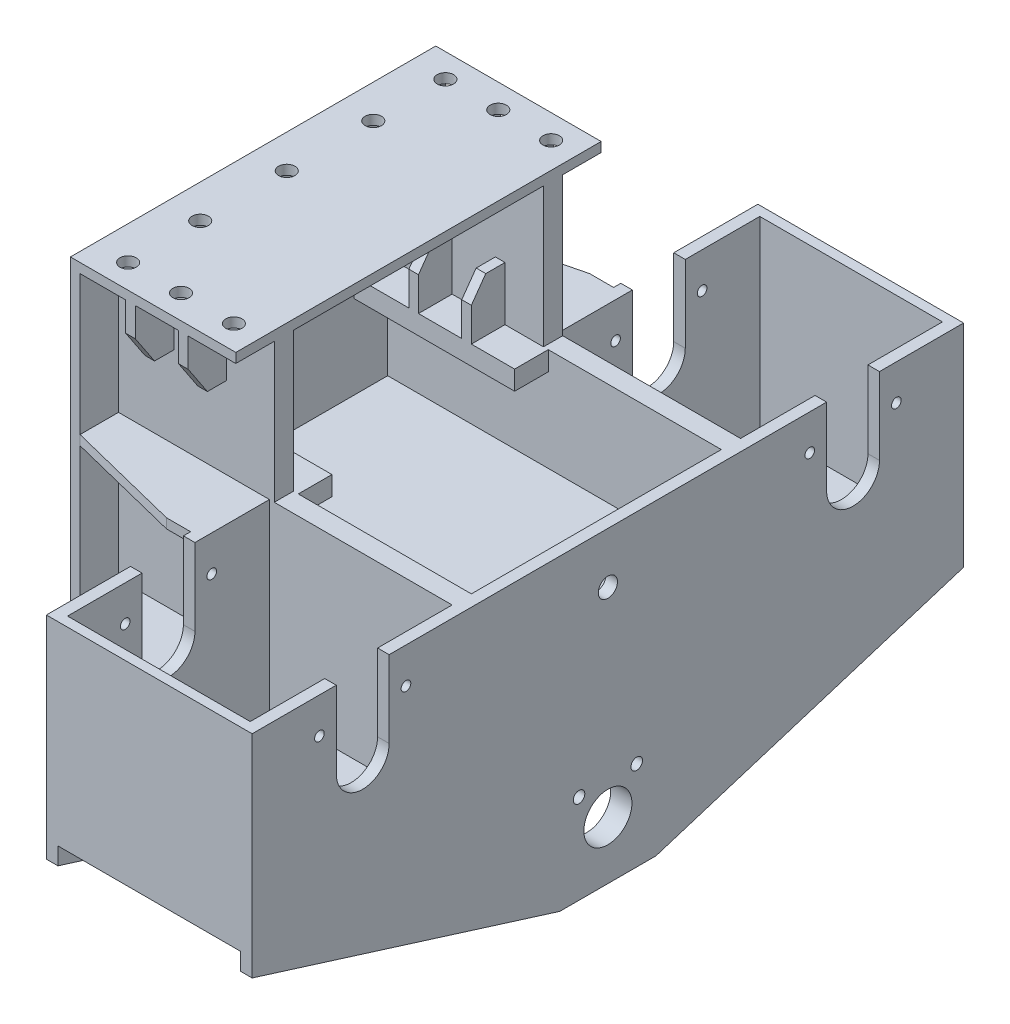
from build123d import *
from build123d.topology import SkipClean

# Parameters (mm, degrees)
SKETCH_1_W             = 172
SKETCH_1_H             = 380
EXTRUDE_1_DEPTH        = 10
SKETCH_2_R             = 8.5
CUT_EXTRUDE_1_DEPTH    = 10
SKETCH_3_W             = 10
SKETCH_3_H             = 380
EXTRUDE_2_DEPTH        = 347
SKETCH_4_R             = 7
CUT_EXTRUDE_2_DEPTH    = 10
SKETCH_5_W             = 162
SKETCH_5_H             = 20
EXTRUDE_3_DEPTH        = 347
SKETCH_6_W             = 20
SKETCH_6_H             = 285
EXTRUDE_4_DEPTH        = 185
SKETCH_9_W             = 5
SKETCH_9_H             = 20
EXTRUDE_6_DEPTH        = 83
SKETCH_7_R             = 5
SKETCH_7_R_2           = 10
SKETCH_7_R_3           = 25
SKETCH_7_R_4           = 6
EXTRUDE_5_DEPTH        = 12
PATTERN_LINEAR_1_COUNT = 2
PATTERN_LINEAR_1_PITCH = 202
CUT_EXTRUDE_3_DEPTH    = 12
EXTRUDE_7_DEPTH        = 347
SKETCH_13_W            = 260
SKETCH_13_H            = 10
EXTRUDE_10_DEPTH       = 359
SKETCH_14_W            = 190
SKETCH_14_H            = 10
EXTRUDE_11_DEPTH       = 190
SKETCH_15_W            = 190
SKETCH_15_H            = 220
EXTRUDE_12_DEPTH       = 12
SKETCH_16_W            = 145
SKETCH_16_H            = 10
EXTRUDE_13_DEPTH       = 80
CUT_EXTRUDE_4_DEPTH    = 790.167916226
SKETCH_18_W            = 70
SKETCH_18_H            = 10
EXTRUDE_14_DEPTH       = 145
CUT_EXTRUDE_5_DEPTH    = 741.935894663
SKETCH_20_W            = 35
SKETCH_20_H            = 20
EXTRUDE_15_DEPTH       = 167
SKETCH_21_W            = 10
SKETCH_21_H            = 56
EXTRUDE_16_DEPTH       = 35
SKETCH_22_W            = 10
SKETCH_22_H            = 56
EXTRUDE_17_DEPTH       = 35
CUT_EXTRUDE_6_DEPTH    = 65
SKETCH_24_W            = 50
SKETCH_24_H            = 10
EXTRUDE_18_DEPTH       = 50
CUT_EXTRUDE_7_DEPTH    = 100
SKETCH_26_W            = 10
SKETCH_26_H            = 40
EXTRUDE_19_DEPTH       = 60
CUT_EXTRUDE_8_DEPTH    = 65
EXTRUDE_START          = 10
SKETCH_28_R            = 25
SKETCH_28_R_2          = 6
EXTRUDE_20_DEPTH       = 10
PATTERN_LINEAR_2_COUNT = 2
PATTERN_LINEAR_2_PITCH = 180


with BuildPart() as part:
    # 草图1 → 凸台-拉伸1 (new body)
    with BuildSketch(Plane(origin=(0, 0, 0), x_dir=(1, 0, 0), z_dir=(0, 1, 0))):
        with Locations((86, 190)):
            Rectangle(SKETCH_1_W, SKETCH_1_H)
    extrude(amount=EXTRUDE_1_DEPTH)

    # 草图2 → 切除-拉伸1 (cut)
    with BuildSketch(Plane(origin=(0, 10, 0), x_dir=(1, 0, 0), z_dir=(0, 1, 0))):
        with Locations(Location((35, 355, 0), (0, 0, 270))):
            Circle(SKETCH_2_R)
        with Locations(Location((35, 280, 0), (0, 0, 270))):
            Circle(SKETCH_2_R)
        with Locations(Location((35, 190, 0), (0, 0, 270))):
            Circle(SKETCH_2_R)
        with Locations(Location((35, 100, 0), (0, 0, 270))):
            Circle(SKETCH_2_R)
        with Locations(Location((35, 25, 0), (0, 0, 270))):
            Circle(SKETCH_2_R)
        with Locations(Location((90, 25, 0), (0, 0, 270))):
            Circle(SKETCH_2_R)
        with Locations(Location((145, 25, 0), (0, 0, 270))):
            Circle(SKETCH_2_R)
        with Locations(Location((90, 355, 0), (0, 0, 270))):
            Circle(SKETCH_2_R)
        with Locations(Location((145, 355, 0), (0, 0, 270))):
            Circle(SKETCH_2_R)
    extrude(amount=-CUT_EXTRUDE_1_DEPTH, mode=Mode.SUBTRACT)

    # 草图3 → 凸台-拉伸2 (add)
    with BuildSketch(Plane.XZ):
        with Locations((5, -190)):
            Rectangle(SKETCH_3_W, SKETCH_3_H)
    extrude(amount=EXTRUDE_2_DEPTH)

    # 草图4 → 切除-拉伸2 (cut)
    with BuildSketch(Plane.ZY):
        with Locations((-133, -75)):
            Circle(SKETCH_4_R)
        with Locations((-247, -75)):
            Circle(SKETCH_4_R)
        with Locations((-133, -118)):
            Circle(SKETCH_4_R)
        with Locations((-247, -118)):
            Circle(SKETCH_4_R)
        Polygon((-235.5, -347), (-144.5, -347), (-190, -324.968736425), align=None)
    extrude(amount=-CUT_EXTRUDE_2_DEPTH, mode=Mode.SUBTRACT)

    # 草图5 → 凸台-拉伸3 (add)
    with BuildSketch(Plane.XZ):
        with Locations((91, -50)):
            Rectangle(SKETCH_5_W, SKETCH_5_H)
        with Locations((91, -330)):
            Rectangle(SKETCH_5_W, SKETCH_5_H)
    extrude(amount=EXTRUDE_3_DEPTH)

    # 草图6 → 凸台-拉伸4 (add)
    with BuildSketch(Plane(origin=(172, 0, 0), x_dir=(0, 0, -1), z_dir=(1, 0, 0))):
        with Locations((50, -287.5)):
            Rectangle(SKETCH_6_W, SKETCH_6_H)
        with Locations((330, -287.5)):
            Rectangle(SKETCH_6_W, SKETCH_6_H)
    extrude(amount=EXTRUDE_4_DEPTH)

    # 草图9 → 凸台-拉伸6 (add)
    with BuildSketch(Plane.XZ.offset(347)):
        with Locations((169.5, -330)):
            Rectangle(SKETCH_9_W, SKETCH_9_H)
        with Locations((169.5, -50)):
            Rectangle(SKETCH_9_W, SKETCH_9_H)
    extrude(amount=EXTRUDE_6_DEPTH)

    # 草图7 → 凸台-拉伸5 (add)
    with BuildSketch(Plane(origin=(357, 0, 0), x_dir=(0, 0, -1), z_dir=(1, 0, 0))):
        with BuildLine():
            Line((-37.5, -145), (417.5, -145))
            Line((417.5, -145), (417.5, -225))
            ThreePointArc((417.5, -225), (445, -252.5), (472.5, -225))
            Line((472.5, -225), (472.5, -145))
            Line((472.5, -145), (560, -145))
            Line((560, -145), (560, -365))
            Line((560, -365), (240, -465))
            Line((240, -465), (140, -465))
            Line((140, -465), (-180, -365))
            Line((-180, -365), (-180, -145))
            Line((-180, -145), (-92.5, -145))
            Line((-92.5, -145), (-92.5, -225))
            ThreePointArc((-92.5, -225), (-65, -252.5), (-37.5, -225))
            Line((-37.5, -225), (-37.5, -145))
        make_face()
        with Locations((490, -182)):
            Circle(SKETCH_7_R, mode=Mode.SUBTRACT)
        with Locations((400, -182)):
            Circle(SKETCH_7_R, mode=Mode.SUBTRACT)
        with Locations((-110, -182)):
            Circle(SKETCH_7_R, mode=Mode.SUBTRACT)
        with Locations((-20, -182)):
            Circle(SKETCH_7_R, mode=Mode.SUBTRACT)
        with Locations((190, -198)):
            Circle(SKETCH_7_R_2, mode=Mode.SUBTRACT)
        with Locations((190, -405)):
            Circle(SKETCH_7_R_3, mode=Mode.SUBTRACT)
        with Locations((160, -372)):
            Circle(SKETCH_7_R_4, mode=Mode.SUBTRACT)
        with Locations((220, -372)):
            Circle(SKETCH_7_R_4, mode=Mode.SUBTRACT)
    extrude_5 = extrude(amount=EXTRUDE_5_DEPTH)

    # 阵列(线性)1: 凸台-拉伸5 ×2
    with Locations(*[(-i * PATTERN_LINEAR_1_PITCH, 0, 0) for i in range(1, PATTERN_LINEAR_1_COUNT)]):
        add(extrude_5)

    # 草图8 → 切除-拉伸3 (cut)
    with BuildSketch(Plane(origin=(167, 0, 0), x_dir=(0, 0, -1), z_dir=(1, 0, 0))):
        Polygon((60, -145), (320, -145), (320, -347), (265, -347), (190, -325), (115, -347), (60, -347), align=None)
    extrude(amount=-CUT_EXTRUDE_3_DEPTH, mode=Mode.SUBTRACT)

    # 草图11 → 凸台-拉伸7 (add)
    with BuildSketch(Plane(origin=(10, 0, 0), x_dir=(0, 0, -1), z_dir=(1, 0, 0))):
        Polygon((60, -335), (115, -335), (190, -313), (265, -335), (320, -335), (320, -347), (265, -347), (190, -325), (115, -347), (60, -347), align=None)
    extrude(amount=EXTRUDE_7_DEPTH)

    # 草图13 → 凸台-拉伸10 (add)
    with BuildSketch(Plane(origin=(369, 0, 0), x_dir=(0, 0, -1), z_dir=(1, 0, 0))):
        with Locations((190, -257)):
            Rectangle(SKETCH_13_W, SKETCH_13_H)
    extrude(amount=-EXTRUDE_10_DEPTH)

    # 草图14 → 凸台-拉伸11 (add)
    with BuildSketch(Plane(origin=(0, -145, 0), x_dir=(1, 0, 0), z_dir=(0, 1, 0))):
        with Locations((262, -175)):
            Rectangle(SKETCH_14_W, SKETCH_14_H)
        with Locations((262, 555)):
            Rectangle(SKETCH_14_W, SKETCH_14_H)
    extrude(amount=-EXTRUDE_11_DEPTH)

    # 草图15 → 凸台-拉伸12 (add)
    with BuildSketch(Plane(origin=(0, -335, 0), x_dir=(-1, 0, 0), z_dir=(0, -1, 0))):
        with Locations((-262, -70)):
            Rectangle(SKETCH_15_W, SKETCH_15_H)
        with Locations((-262, 450)):
            Rectangle(SKETCH_15_W, SKETCH_15_H)
    extrude(amount=EXTRUDE_12_DEPTH)

    # 草图16 → 凸台-拉伸13 (add)
    with BuildSketch(Plane(origin=(0, -347, 0), x_dir=(-1, 0, 0), z_dir=(0, -1, 0))):
        with Locations((-82.5, 45)):
            Rectangle(SKETCH_16_W, SKETCH_16_H)
        with Locations((-82.5, 335)):
            Rectangle(SKETCH_16_W, SKETCH_16_H)
    extrude(amount=EXTRUDE_13_DEPTH)

    # 草图17 → 切除-拉伸4 (cut, through all)
    with BuildSketch(Plane.XY.offset(-40)):
        Polygon((10, -427), (10, -397), (55, -427), align=None)
    extrude(amount=-CUT_EXTRUDE_4_DEPTH, mode=Mode.SUBTRACT)

    # 草图18 → 凸台-拉伸14 (add)
    with BuildSketch(Plane.ZY.offset(-155)):
        with Locations((-5, -150)):
            Rectangle(SKETCH_18_W, SKETCH_18_H)
        with Locations((-375, -150)):
            Rectangle(SKETCH_18_W, SKETCH_18_H)
        with Locations((-375, -300)):
            Rectangle(SKETCH_18_W, SKETCH_18_H)
        with Locations((-5, -300)):
            Rectangle(SKETCH_18_W, SKETCH_18_H)
    extrude(amount=EXTRUDE_14_DEPTH)

    # 草图19 → 切除-拉伸5 (cut, through all)
    with BuildSketch(Plane(origin=(0, -305, 0), x_dir=(-1, 0, 0), z_dir=(0, -1, 0))):
        Polygon((-10, -30), (-10, 0), (-130, -30), align=None)
        Polygon((-10, 410), (-10, 380), (-130, 410), align=None)
    extrude(amount=-CUT_EXTRUDE_5_DEPTH, mode=Mode.SUBTRACT)

    # 草图20 → 凸台-拉伸15 (add)
    with BuildSketch(Plane(origin=(10, 0, 0), x_dir=(0, 0, -1), z_dir=(1, 0, 0))):
        with Locations((77.5, -155)):
            Rectangle(SKETCH_20_W, SKETCH_20_H)
        with Locations((302.5, -155)):
            Rectangle(SKETCH_20_W, SKETCH_20_H)
    extrude(amount=EXTRUDE_15_DEPTH)

    # 草图21 → 凸台-拉伸16 (add)
    with BuildSketch(Plane.XY.offset(-320)):
        with Locations((72, -117)):
            Rectangle(SKETCH_21_W, SKETCH_21_H)
        with Locations((127, -117)):
            Rectangle(SKETCH_21_W, SKETCH_21_H)
    extrude(amount=EXTRUDE_16_DEPTH)

    # 草图22 → 凸台-拉伸17 (add)
    with BuildSketch(Plane(origin=(0, 0, -60), x_dir=(-1, 0, 0), z_dir=(0, 0, -1))):
        with Locations((-127, -117)):
            Rectangle(SKETCH_22_W, SKETCH_22_H)
        with Locations((-72, -117)):
            Rectangle(SKETCH_22_W, SKETCH_22_H)
    extrude(amount=EXTRUDE_17_DEPTH)

    # 草图23 → 切除-拉伸6 (cut)
    with BuildSketch(Plane(origin=(132, 0, 0), x_dir=(0, 0, -1), z_dir=(1, 0, 0))):
        Polygon((95, -89), (80, -89), (95, -110), align=None)
        Polygon((285, -89), (300, -89), (285, -110), align=None)
    extrude(amount=-CUT_EXTRUDE_6_DEPTH, mode=Mode.SUBTRACT)

    # 草图24 → 凸台-拉伸18 (add)
    with BuildSketch(Plane.XZ):
        with Locations((35, -145)):
            Rectangle(SKETCH_24_W, SKETCH_24_H)
        with Locations((35, -235)):
            Rectangle(SKETCH_24_W, SKETCH_24_H)
    extrude(amount=EXTRUDE_18_DEPTH)

    # 草图25 → 切除-拉伸7 (cut)
    with BuildSketch(Plane(origin=(0, 0, -240), x_dir=(-1, 0, 0), z_dir=(0, 0, -1))):
        Polygon((-60, -50), (-60, -20), (-30, -50), align=None)
    extrude(amount=-CUT_EXTRUDE_7_DEPTH, mode=Mode.SUBTRACT)

    # 草图26 → 凸台-拉伸19 (add)
    with BuildSketch(Plane.XZ):
        with Locations((117.5, -360)):
            Rectangle(SKETCH_26_W, SKETCH_26_H)
        with Locations((62.5, -360)):
            Rectangle(SKETCH_26_W, SKETCH_26_H)
        with Locations((117.5, -20)):
            Rectangle(SKETCH_26_W, SKETCH_26_H)
        with Locations((62.5, -20)):
            Rectangle(SKETCH_26_W, SKETCH_26_H)
    extrude(amount=EXTRUDE_19_DEPTH)

    # 草图27 → 切除-拉伸8 (cut)
    with BuildSketch(Plane.ZY.offset(-57.5)):
        Polygon((0, -60), (-20, -60), (0, -30), align=None)
        Polygon((-380, -60), (-360, -60), (-380, -30), align=None)
    extrude(amount=-CUT_EXTRUDE_8_DEPTH, mode=Mode.SUBTRACT)

    # 草图28 → 凸台-拉伸20 (add)
    with SkipClean():  # the faces are left unmerged after this step: merging them gives an invalid solid
        with BuildSketch(Plane.ZY.offset(-357).offset(EXTRUDE_START)):
            with BuildLine():
                Line((-226.055512755, -465), (-153.944487245, -465))
                ThreePointArc((-153.944487245, -465), (-190, -335), (-226.055512755, -465))
            make_face()
            with Locations((-190, -405)):
                Circle(SKETCH_28_R, mode=Mode.SUBTRACT)
            with Locations((-220, -372)):
                Circle(SKETCH_28_R_2, mode=Mode.SUBTRACT)
            with Locations((-160, -372)):
                Circle(SKETCH_28_R_2, mode=Mode.SUBTRACT)
        extrude_20 = extrude(amount=-EXTRUDE_20_DEPTH)

    # 阵列(线性)2: 凸台-拉伸20 ×2
    with SkipClean():  # the faces are left unmerged after this step: merging them gives an invalid solid
        with Locations(*[(-i * PATTERN_LINEAR_2_PITCH, 0, 0) for i in range(1, PATTERN_LINEAR_2_COUNT)]):
            add(extrude_20)


solid = part.part
